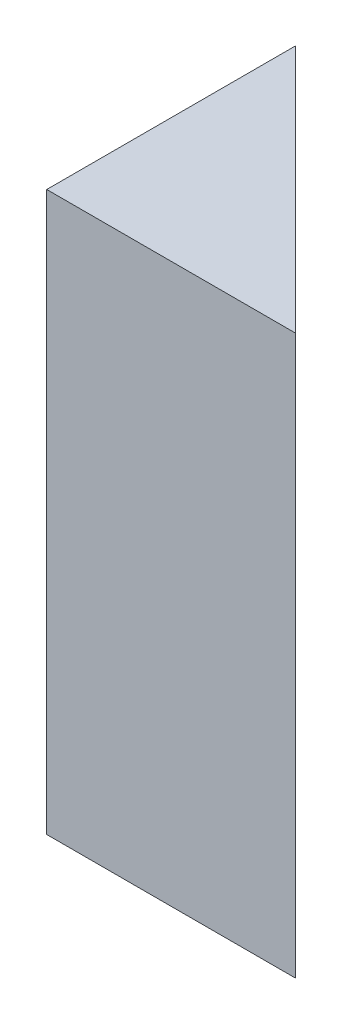
from build123d import *

# Parameters (mm, degrees)
BOSS_EXTRUDE1_DEPTH = 44.958


with BuildPart() as part:
    # Sketch1 → Boss-Extrude1 (new body)
    with BuildSketch(Plane(origin=(0, 0, 0), x_dir=(1, 0, 0), z_dir=(0, 1, 0))):
        Polygon((0, 0), (20, 0), (0, 20), align=None)
    extrude(amount=BOSS_EXTRUDE1_DEPTH)


solid = part.part
